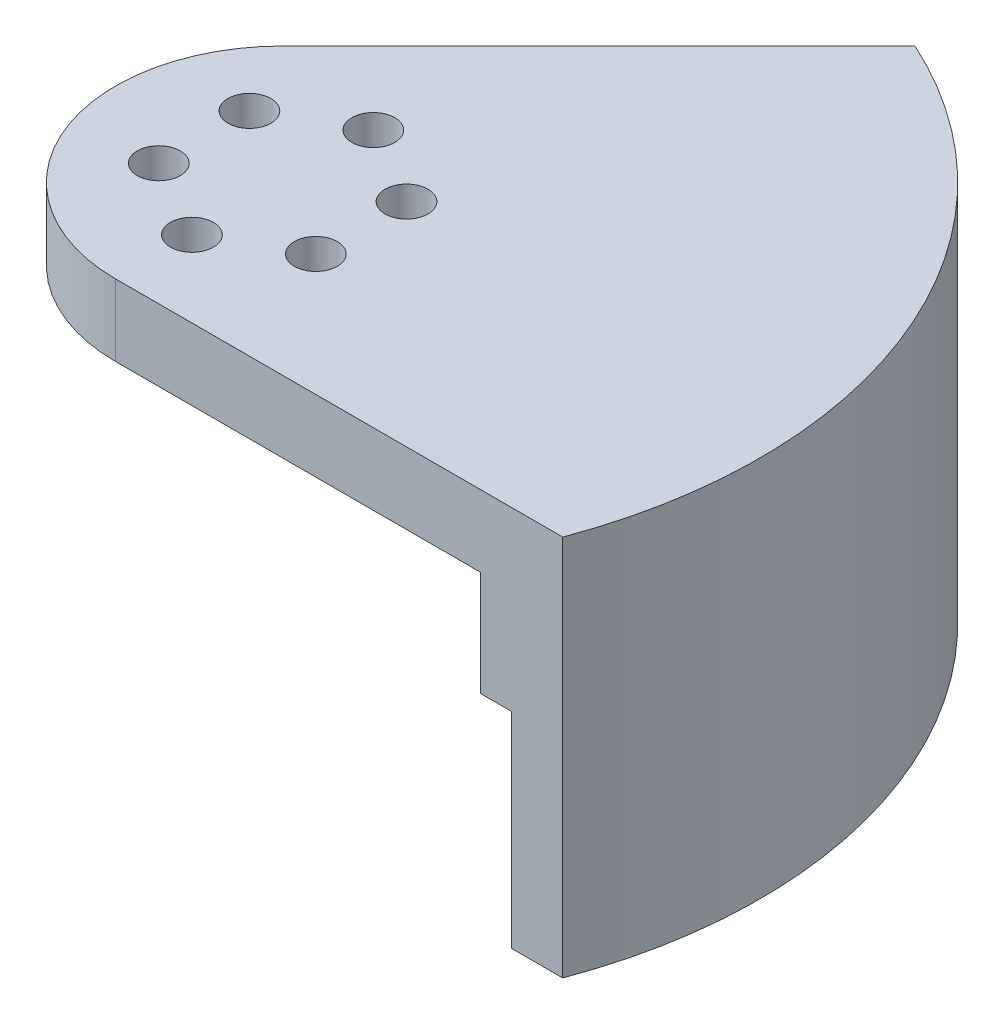
from build123d import *

# Parameters (mm, degrees)
BOSS_EXTRUDE1_DEPTH = 15
SKETCH2_R           = 4.5
CUT_EXTRUDE1_DEPTH  = 9
SKETCH3_R           = 2.75
CUT_EXTRUDE2_DEPTH  = 136.49768983
BOSS_EXTRUDE2_START = 65
BOSS_EXTRUDE2_DEPTH = 65
BOSS_EXTRUDE3_START = 22
BOSS_EXTRUDE3_DEPTH = 22
SKETCH6_R           = 2.5
CUT_EXTRUDE3_DEPTH  = 4


with BuildPart() as part:
    # Sketch1 → Boss-Extrude1 (new body)
    with BuildSketch(Plane(origin=(0, 0, 0), x_dir=(1, 0, 0), z_dir=(0, 1, 0))):
        with BuildLine():
            Line((-24.748737342, 24.748737342), (41.489469156, 90.986943839))
            ThreePointArc((41.489469156, 90.986943839), (92.387953251, 38.268343237), (93.674969976, -35))
            Line((93.674969976, -35), (0, -35))
            ThreePointArc((0, -35), (-32.335783638, -13.393920133), (-24.748737342, 24.748737342))
        make_face()
    extrude(amount=BOSS_EXTRUDE1_DEPTH)

    # Sketch2 → Cut-Extrude1 (cut)
    with BuildSketch(Plane(origin=(0, 15, 0), x_dir=(1, 0, 0), z_dir=(0, 1, 0))):
        with Locations(Location((0, 19, 0), (0, 0, 270))):
            Circle(SKETCH2_R)
        with Locations(Location((16.454482672, 9.5, 0), (0, 0, 270))):
            Circle(SKETCH2_R)
        with Locations(Location((16.454482672, -9.5, 0), (0, 0, 270))):
            Circle(SKETCH2_R)
        with Locations(Location((0, -19, 0), (0, 0, 270))):
            Circle(SKETCH2_R)
        with Locations(Location((-16.454482672, -9.5, 0), (0, 0, 270))):
            Circle(SKETCH2_R)
        with Locations(Location((-16.454482672, 9.5, 0), (0, 0, 270))):
            Circle(SKETCH2_R)
    extrude(amount=-CUT_EXTRUDE1_DEPTH, mode=Mode.SUBTRACT)

    # Sketch3 → Cut-Extrude2 (cut, through all)
    with BuildSketch(Plane(origin=(0, 6, 0), x_dir=(1, 0, 0), z_dir=(0, 1, 0))):
        with Locations(Location((0, 19, 0), (0, 0, 270))):
            Circle(SKETCH3_R)
        with Locations(Location((16.454482672, 9.5, 0), (0, 0, 270))):
            Circle(SKETCH3_R)
        with Locations(Location((16.454482672, -9.5, 0), (0, 0, 270))):
            Circle(SKETCH3_R)
        with Locations(Location((0, -19, 0), (0, 0, 270))):
            Circle(SKETCH3_R)
        with Locations(Location((-16.454482672, -9.5, 0), (0, 0, 270))):
            Circle(SKETCH3_R)
        with Locations(Location((-16.454482672, 9.5, 0), (0, 0, 270))):
            Circle(SKETCH3_R)
    extrude(amount=-CUT_EXTRUDE2_DEPTH, mode=Mode.SUBTRACT)

    # Sketch4 → Boss-Extrude2 (add)
    with BuildSketch(Plane.XZ.offset(BOSS_EXTRUDE2_START)):
        with BuildLine():
            Line((93.674969976, 35), (82.915619759, 35))
            ThreePointArc((82.915619759, 35), (83.149157926, -34.441508913), (33.881459656, -83.378934339))
            Line((33.881459656, -83.378934339), (41.489469156, -90.986943839))
            ThreePointArc((41.489469156, -90.986943839), (92.387953251, -38.268343237), (93.674969976, 35))
        make_face()
    extrude(amount=-BOSS_EXTRUDE2_DEPTH)

    # Sketch5 → Boss-Extrude3 (add)
    with BuildSketch(Plane.XZ.offset(BOSS_EXTRUDE3_START)):
        with BuildLine():
            Line((80.428539711, 23.5), (86.877787725, 23.5))
            ThreePointArc((86.877787725, 23.5), (85.091202872, 29.317012019), (82.915619759, 35))
            Line((82.915619759, 35), (76.428539711, 35))
            Line((76.428539711, 35), (76.428539711, 27.5))
            ThreePointArc((76.428539711, 27.5), (77.600112586, 24.671572875), (80.428539711, 23.5))
        make_face()
        with BuildLine():
            Line((34.597702223, -73.488575188), (29.294401364, -78.791876047))
            Line((29.294401364, -78.791876047), (33.881459656, -83.378934339))
            ThreePointArc((33.881459656, -83.378934339), (39.438308567, -80.898824573), (44.814863477, -78.048882193))
            Line((44.814863477, -78.048882193), (40.254556473, -73.488575188))
            ThreePointArc((40.254556473, -73.488575188), (37.426129348, -72.317002313), (34.597702223, -73.488575188))
        make_face()
    extrude(amount=-BOSS_EXTRUDE3_DEPTH)

    # Sketch6 → Cut-Extrude3 (cut)
    with BuildSketch(Plane.XZ.offset(22)):
        with Locations(Location((80.428539711, 27.5, 0), (0, 0, 270))):
            Circle(SKETCH6_R)
        with Locations(Location((37.426129348, -76.317002313, 0), (0, 0, 270))):
            Circle(SKETCH6_R)
    extrude(amount=-CUT_EXTRUDE3_DEPTH, mode=Mode.SUBTRACT)


solid = part.part
